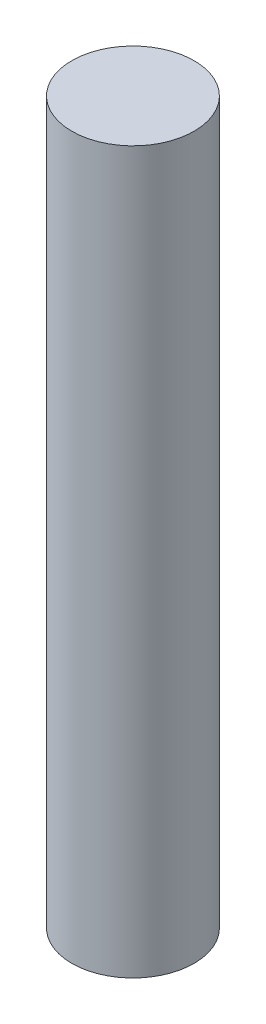
from build123d import *

# Parameters (mm, degrees)
SKETCH_1_R      = 1.4
EXTRUDE_1_DEPTH = 16.5


with BuildPart() as part:
    # 草图1 → 凸台-拉伸1 (new body)
    with BuildSketch(Plane(origin=(0, 0, 0), x_dir=(1, 0, 0), z_dir=(0, 1, 0))):
        with Locations(Location((0, 0, 0), (0, 0, 270))):
            Circle(SKETCH_1_R)
    extrude(amount=EXTRUDE_1_DEPTH)


solid = part.part
